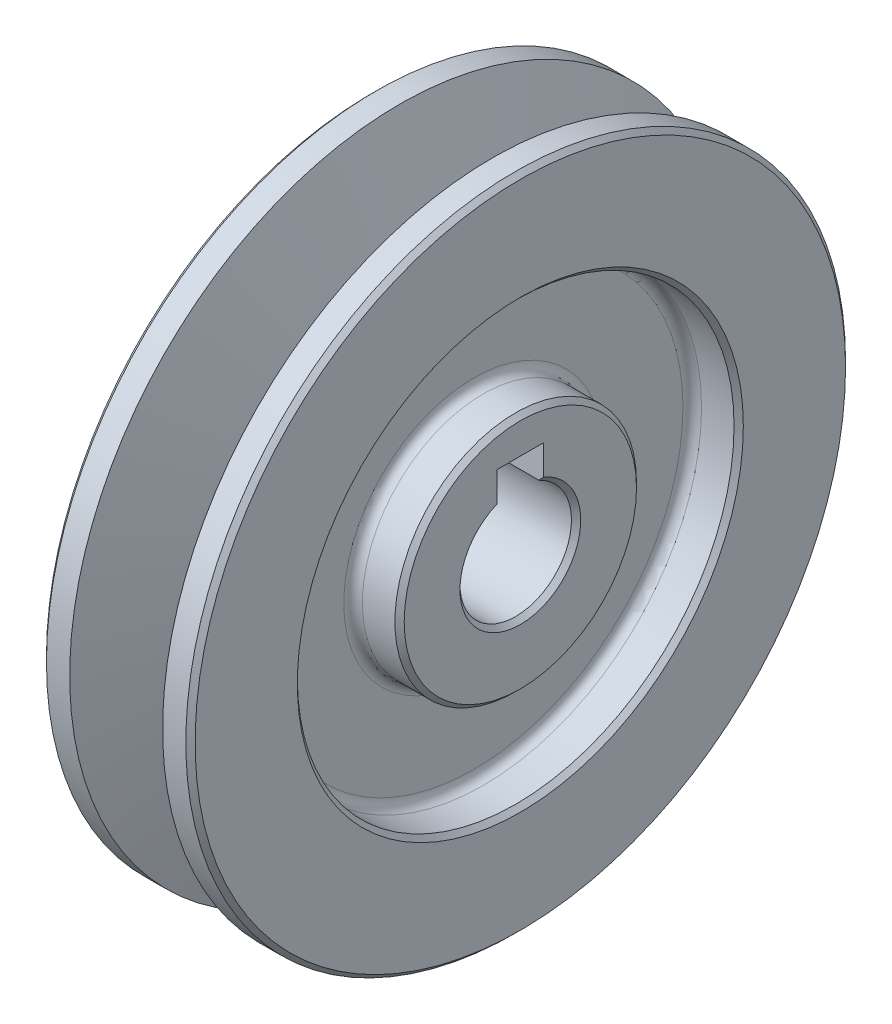
from build123d import *

# Parameters (mm, degrees)
CHAMFER1_SIZE      = 0.5
CHAMFER2_SIZE      = 0.5
FILLET2_R          = 1
CUT_EXTRUDE1_DEPTH = 53.692504211
FILLET3_R          = 1
CHAMFER3_SIZE      = 0.5


with BuildPart() as part:
    # Sketch1 → Revolve1 (revolve)
    with BuildSketch(Plane(origin=(0, 0, 0), x_dir=(1, 0, 0), z_dir=(0, 1, 0))):
        Polygon((-8, 35.5), (-8, 23.5), (-3, 23.5), (-3, 13), (-8, 13), (-8, 6), (8, 6), (8, 13), (3, 13), (3, 23.5), (8, 23.5), (8, 35.5), (5, 35.5), (1.942693185, 25.5), (-1.942693185, 25.5), (-5, 35.5), align=None)
    revolve(axis=Axis((0, 0, 0), (-1, 0, 0)))

    # Chamfer1
    chamfer1_edges = [part.edges().sort_by_distance(p)[0] for p in [
        (8, 0, 6),
        (8, 0, 13),
        (8, 0, 35.5),
    ]]
    chamfer(chamfer1_edges, length=CHAMFER1_SIZE)

    # Chamfer2
    chamfer2_edges = [part.edges().sort_by_distance(p)[0] for p in [
        (-8, 0, 35.5),
        (-8, 0, 23.5),
        (-8, 0, 13),
        (-8, 0, 6),
    ]]
    chamfer(chamfer2_edges, length=CHAMFER2_SIZE)

    # Fillet2
    fillet2_edges = [part.edges().sort_by_distance(p)[0] for p in [
        (-3, 0, 23.5),
        (-3, 0, 13),
    ]]
    fillet(fillet2_edges, radius=FILLET2_R)

    # Sketch2 → Cut-Extrude1 (cut, through all)
    with BuildSketch(Plane(origin=(8, 0, 0), x_dir=(0, 0, -1), z_dir=(1, 0, 0))):
        Polygon((-2.5, 9.2), (-2.5, 4.689453437), (2.5, 4.689453437), (2.5, 6), (2.5, 9.2), align=None)
    extrude(amount=-CUT_EXTRUDE1_DEPTH, mode=Mode.SUBTRACT)

    # Fillet3
    fillet3_edges = [part.edges().sort_by_distance(p)[0] for p in [
        (3, 0, 13),
        (3, 0, 23.5),
    ]]
    fillet(fillet3_edges, radius=FILLET3_R)

    # Chamfer3
    chamfer3_edges = [part.edges().sort_by_distance(p)[0] for p in [
        (8, 0, 23.5),
    ]]
    chamfer(chamfer3_edges, length=CHAMFER3_SIZE)


solid = part.part
